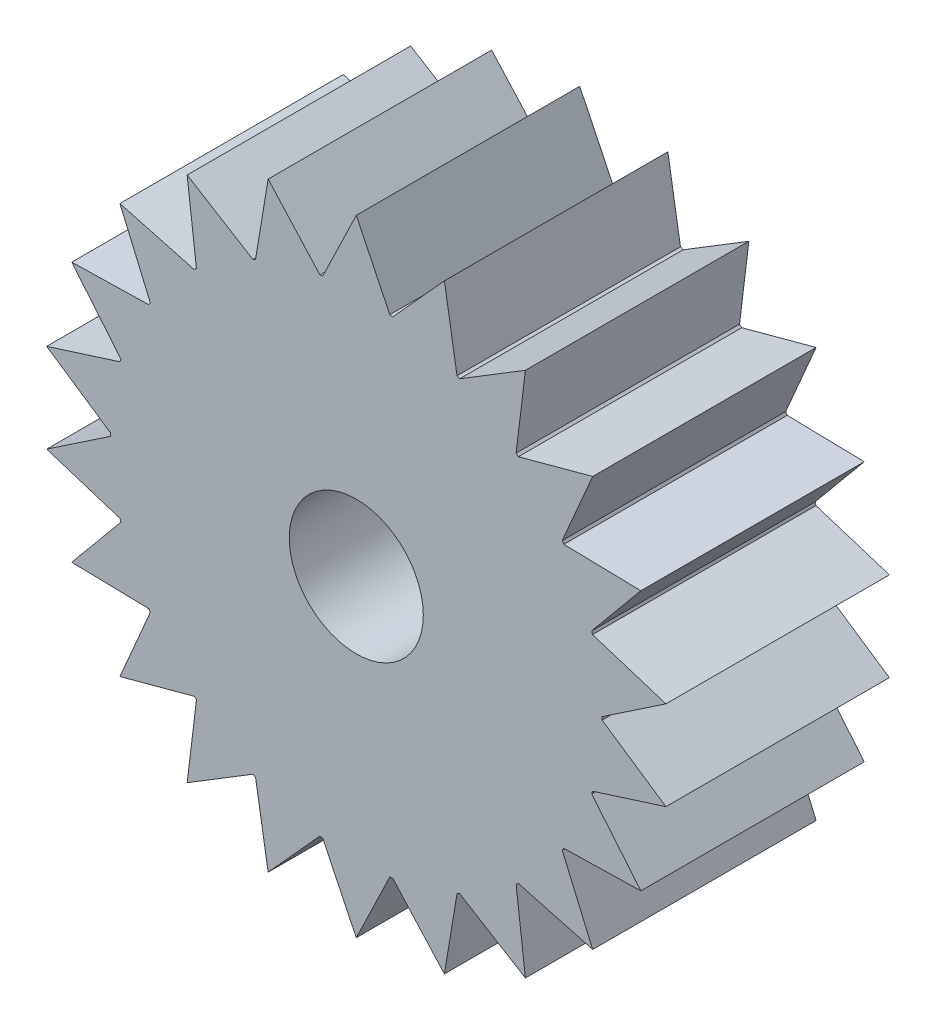
from build123d import *

# Parameters (mm, degrees)
ESQUISSE2_W        = 10
ESQUISSE2_H        = 8
BOSS_EXTRU_1_START = -10
BOSS_EXTRU_1_DEPTH = 10


with BuildPart() as part:
    # Esquisse2 → Révolution1 (revolve)
    with BuildSketch(Plane(origin=(0, 0, 0), x_dir=(0, 0, -1), z_dir=(1, 0, 0)), mode=Mode.PRIVATE) as r_volution1_sk:
        with Locations((5, 7)):
            Rectangle(ESQUISSE2_W, ESQUISSE2_H)
    revolve(r_volution1_sk.sketch.rotate(Axis((0, 0, 0), (0, 0, -1)), 90), axis=Axis((0, 0, 0), (0, 0, -1)))

    # Esquisse3 → Boss.-Extru.1 (add)
    with BuildSketch(Plane.XY.offset(BOSS_EXTRU_1_START)):
        with BuildLine():
            Line((0, 14), (-1.5, 10.897247359))
            ThreePointArc((-1.5, 10.897247359), (-0.751757625, 10.974281775), (0, 11))
            ThreePointArc((0, 11), (0.751757625, 10.974281775), (1.5, 10.897247359))
            Line((1.5, 10.897247359), (0, 14))
        make_face()
        with BuildLine():
            Line((3.944255796, 13.432901631), (4.509348821, 10.033233437))
            ThreePointArc((4.509348821, 10.033233437), (3.813118623, 10.317951656), (3.099058125, 10.55442271))
            ThreePointArc((3.099058125, 10.55442271), (2.370506305, 10.741540851), (1.630869901, 10.878431108))
            Line((1.630869901, 10.878431108), (3.944255796, 13.432901631))
        make_face()
        with BuildLine():
            Line((7.568971444, 11.77754946), (7.153377019, 8.356386613))
            ThreePointArc((7.153377019, 8.356386613), (6.565563427, 8.825722457), (5.947048992, 9.253788861))
            ThreePointArc((5.947048992, 9.253788861), (5.300725912, 9.63858417), (4.629616421, 9.978309065))
            Line((4.629616421, 9.978309065), (7.568971444, 11.77754946))
        make_face()
        with BuildLine():
            Line((10.580494041, 9.168050275), (9.217881154, 6.002555042))
            ThreePointArc((9.217881154, 6.002555042), (8.78610533, 6.618485713), (8.313245318, 7.203468073))
            ThreePointArc((8.313245318, 7.203468073), (7.80151223, 7.754766722), (7.253298952, 8.269803765))
            Line((7.253298952, 8.269803765), (10.580494041, 9.168050275))
        make_face()
        with BuildLine():
            Line((12.734847935, 5.815810182), (10.535607378, 3.16243216))
            ThreePointArc((10.535607378, 3.16243216), (10.294849232, 3.875058618), (10.005951949, 4.569565143))
            ThreePointArc((10.005951949, 4.569565143), (9.670266425, 5.242704194), (9.289362339, 5.891328146))
            Line((9.289362339, 5.891328146), (12.734847935, 5.815810182))
        make_face()
        with BuildLine():
            Line((13.857500186, 1.992407736), (10.999801351, 0.066107833))
            ThreePointArc((10.999801351, 0.066107833), (10.969565675, 0.81769732), (10.888035861, 1.565463221))
            ThreePointArc((10.888035861, 1.565463221), (10.755593145, 2.305908952), (10.572856836, 3.035572158))
            Line((10.572856836, 3.035572158), (13.857500186, 1.992407736))
        make_face()
        with BuildLine():
            Line((13.857500186, -1.992407736), (10.572856836, -3.035572158))
            ThreePointArc((10.572856836, -3.035572158), (10.755593145, -2.305908952), (10.888035861, -1.565463221))
            ThreePointArc((10.888035861, -1.565463221), (10.969565675, -0.81769732), (10.999801351, -0.066107833))
            Line((10.999801351, -0.066107833), (13.857500186, -1.992407736))
        make_face()
        with BuildLine():
            Line((12.734847935, -5.815810182), (9.289362339, -5.891328146))
            ThreePointArc((9.289362339, -5.891328146), (9.670266425, -5.242704194), (10.005951949, -4.569565143))
            ThreePointArc((10.005951949, -4.569565143), (10.294849232, -3.875058618), (10.535607378, -3.16243216))
            Line((10.535607378, -3.16243216), (12.734847935, -5.815810182))
        make_face()
        with BuildLine():
            Line((10.580494041, -9.168050275), (7.253298952, -8.269803765))
            ThreePointArc((7.253298952, -8.269803765), (7.80151223, -7.754766722), (8.313245318, -7.203468073))
            ThreePointArc((8.313245318, -7.203468073), (8.78610533, -6.618485713), (9.217881154, -6.002555042))
            Line((9.217881154, -6.002555042), (10.580494041, -9.168050275))
        make_face()
        with BuildLine():
            Line((7.568971444, -11.77754946), (4.629616421, -9.978309065))
            ThreePointArc((4.629616421, -9.978309065), (5.300725912, -9.63858417), (5.947048992, -9.253788861))
            ThreePointArc((5.947048992, -9.253788861), (6.565563427, -8.825722457), (7.153377019, -8.356386613))
            Line((7.153377019, -8.356386613), (7.568971444, -11.77754946))
        make_face()
        with BuildLine():
            Line((3.944255796, -13.432901631), (1.630869901, -10.878431108))
            ThreePointArc((1.630869901, -10.878431108), (2.370506305, -10.741540851), (3.099058125, -10.55442271))
            ThreePointArc((3.099058125, -10.55442271), (3.813118623, -10.317951656), (4.509348821, -10.033233437))
            Line((4.509348821, -10.033233437), (3.944255796, -13.432901631))
        make_face()
        with BuildLine():
            Line((0, -14), (-1.5, -10.897247359))
            ThreePointArc((-1.5, -10.897247359), (-0.751757625, -10.974281775), (0, -11))
            ThreePointArc((0, -11), (0.751757625, -10.974281775), (1.5, -10.897247359))
            Line((1.5, -10.897247359), (0, -14))
        make_face()
        with BuildLine():
            Line((-3.944255796, -13.432901631), (-4.509348821, -10.033233437))
            ThreePointArc((-4.509348821, -10.033233437), (-3.813118623, -10.317951656), (-3.099058125, -10.55442271))
            ThreePointArc((-3.099058125, -10.55442271), (-2.370506305, -10.741540851), (-1.630869901, -10.878431108))
            Line((-1.630869901, -10.878431108), (-3.944255796, -13.432901631))
        make_face()
        with BuildLine():
            Line((-7.568971444, -11.77754946), (-7.153377019, -8.356386613))
            ThreePointArc((-7.153377019, -8.356386613), (-6.565563427, -8.825722457), (-5.947048992, -9.253788861))
            ThreePointArc((-5.947048992, -9.253788861), (-5.300725912, -9.63858417), (-4.629616421, -9.978309065))
            Line((-4.629616421, -9.978309065), (-7.568971444, -11.77754946))
        make_face()
        with BuildLine():
            Line((-10.580494041, -9.168050275), (-9.217881154, -6.002555042))
            ThreePointArc((-9.217881154, -6.002555042), (-8.78610533, -6.618485713), (-8.313245318, -7.203468073))
            ThreePointArc((-8.313245318, -7.203468073), (-7.80151223, -7.754766722), (-7.253298952, -8.269803765))
            Line((-7.253298952, -8.269803765), (-10.580494041, -9.168050275))
        make_face()
        with BuildLine():
            Line((-12.734847935, -5.815810182), (-10.535607378, -3.16243216))
            ThreePointArc((-10.535607378, -3.16243216), (-10.294849232, -3.875058618), (-10.005951949, -4.569565143))
            ThreePointArc((-10.005951949, -4.569565143), (-9.670266425, -5.242704194), (-9.289362339, -5.891328146))
            Line((-9.289362339, -5.891328146), (-12.734847935, -5.815810182))
        make_face()
        with BuildLine():
            Line((-13.857500186, -1.992407736), (-10.999801351, -0.066107833))
            ThreePointArc((-10.999801351, -0.066107833), (-10.969565675, -0.81769732), (-10.888035861, -1.565463221))
            ThreePointArc((-10.888035861, -1.565463221), (-10.755593145, -2.305908952), (-10.572856836, -3.035572158))
            Line((-10.572856836, -3.035572158), (-13.857500186, -1.992407736))
        make_face()
        with BuildLine():
            Line((-13.857500186, 1.992407736), (-10.572856836, 3.035572158))
            ThreePointArc((-10.572856836, 3.035572158), (-10.755593145, 2.305908952), (-10.888035861, 1.565463221))
            ThreePointArc((-10.888035861, 1.565463221), (-10.969565675, 0.81769732), (-10.999801351, 0.066107833))
            Line((-10.999801351, 0.066107833), (-13.857500186, 1.992407736))
        make_face()
        with BuildLine():
            Line((-12.734847935, 5.815810182), (-9.289362339, 5.891328146))
            ThreePointArc((-9.289362339, 5.891328146), (-9.670266425, 5.242704194), (-10.005951949, 4.569565143))
            ThreePointArc((-10.005951949, 4.569565143), (-10.294849232, 3.875058618), (-10.535607378, 3.16243216))
            Line((-10.535607378, 3.16243216), (-12.734847935, 5.815810182))
        make_face()
        with BuildLine():
            Line((-10.580494041, 9.168050275), (-7.253298952, 8.269803765))
            ThreePointArc((-7.253298952, 8.269803765), (-7.80151223, 7.754766722), (-8.313245318, 7.203468073))
            ThreePointArc((-8.313245318, 7.203468073), (-8.78610533, 6.618485713), (-9.217881154, 6.002555042))
            Line((-9.217881154, 6.002555042), (-10.580494041, 9.168050275))
        make_face()
        with BuildLine():
            Line((-7.568971444, 11.77754946), (-4.629616421, 9.978309065))
            ThreePointArc((-4.629616421, 9.978309065), (-5.300725912, 9.63858417), (-5.947048992, 9.253788861))
            ThreePointArc((-5.947048992, 9.253788861), (-6.565563427, 8.825722457), (-7.153377019, 8.356386613))
            Line((-7.153377019, 8.356386613), (-7.568971444, 11.77754946))
        make_face()
        with BuildLine():
            Line((-3.944255796, 13.432901631), (-1.630869901, 10.878431108))
            ThreePointArc((-1.630869901, 10.878431108), (-2.370506305, 10.741540851), (-3.099058125, 10.55442271))
            ThreePointArc((-3.099058125, 10.55442271), (-3.813118623, 10.317951656), (-4.509348821, 10.033233437))
            Line((-4.509348821, 10.033233437), (-3.944255796, 13.432901631))
        make_face()
    extrude(amount=BOSS_EXTRU_1_DEPTH)


solid = part.part
